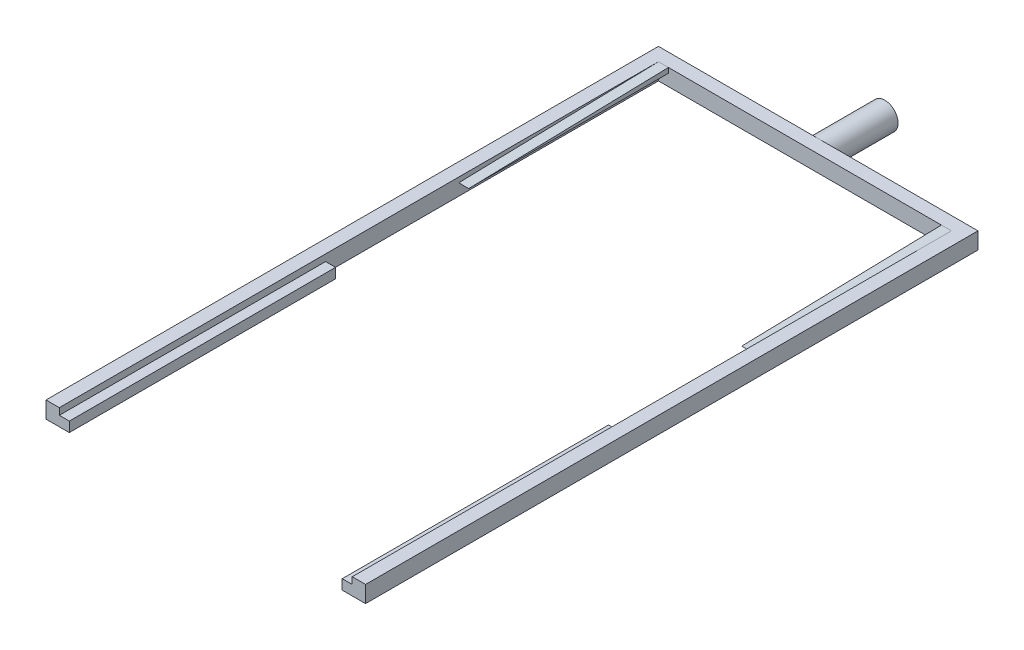
from build123d import *

# Parameters (mm, degrees)
BOSS_EXTRUDE1_DEPTH = 2.5
SKETCH4_W           = 40
SKETCH4_H           = 1.5
BOSS_EXTRUDE3_DEPTH = 1.5
SKETCH6_R           = 2
BOSS_EXTRUDE4_DEPTH = 10


with BuildPart() as part:
    # Sketch2 → Boss-Extrude1 (new body)
    with BuildSketch(Plane(origin=(0, 0, 0), x_dir=(1, 0, 0), z_dir=(0, 1, 0))):
        Polygon((-22, -45), (-22, 45), (22, 45), (22, -45), (24, -45), (24, 47), (-24, 47), (-24, -45), align=None)
    extrude(amount=BOSS_EXTRUDE1_DEPTH)

    # Sketch4 → Boss-Extrude3 (add)
    with BuildSketch(Plane(origin=(-22, 0, 0), x_dir=(0, 0, -1), z_dir=(1, 0, 0))):
        Polygon((45, 1.75), (15, 1.75), (45, 2.5), align=None)
        with Locations((-25, 0.75)):
            Rectangle(SKETCH4_W, SKETCH4_H)
    boss_extrude3 = extrude(amount=BOSS_EXTRUDE3_DEPTH)

    # Mirror1: Boss-Extrude3 across plane
    add(boss_extrude3.mirror(Plane(origin=(0, 0, 0), x_dir=(0, 0, 1), z_dir=(1, 0, 0))))

    # Sketch6 → Boss-Extrude4 (add)
    with BuildSketch(Plane(origin=(0, 0, -47), x_dir=(-1, 0, 0), z_dir=(0, 0, -1))):
        with Locations(Location((0, 0.5, 0), (0, 0, 194.477512186))):
            Circle(SKETCH6_R)
    extrude(amount=BOSS_EXTRUDE4_DEPTH)


solid = part.part
